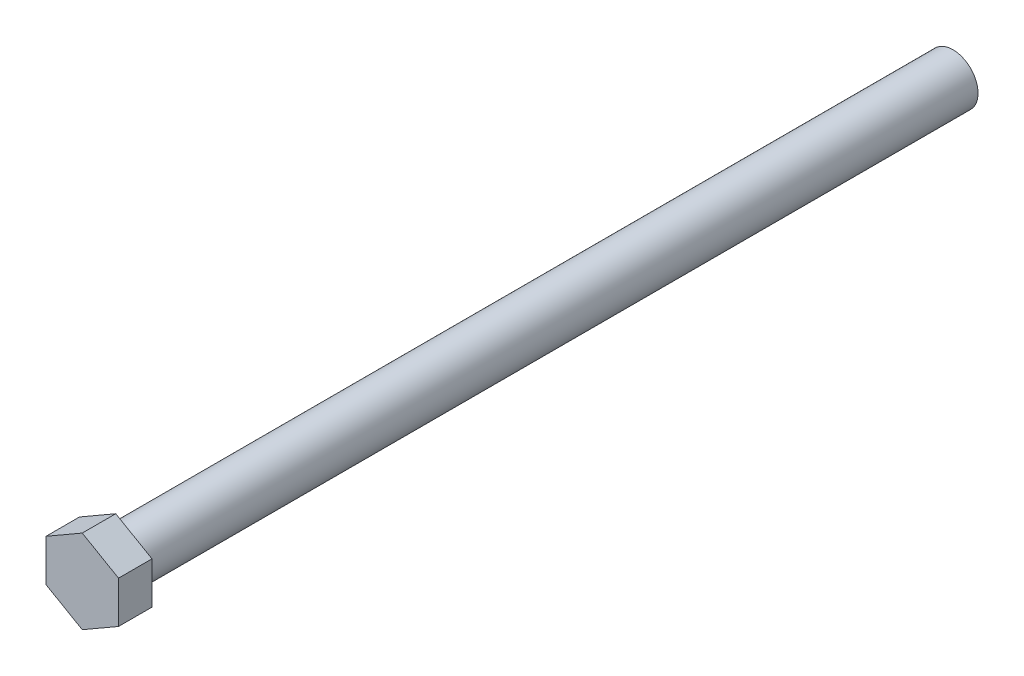
from build123d import *

# Parameters (mm, degrees)
BOSS_EXTRUDE1_DEPTH = 4
SKETCH2_R           = 3
BOSS_EXTRUDE2_DEPTH = 100


with BuildPart() as part:
    # Sketch1 → Boss-Extrude1 (new body)
    with BuildSketch(Plane(origin=(0, 0, 0), x_dir=(0, 1, 0), z_dir=(0, 0, 1))):
        Polygon((2.5, 4.330127019), (-2.5, 4.330127019), (-5, 0), (-2.5, -4.330127019), (2.5, -4.330127019), (5, 0), align=None)
    extrude(amount=BOSS_EXTRUDE1_DEPTH)

    # Sketch2 → Boss-Extrude2 (add)
    with BuildSketch(Plane(origin=(0, 0, 0), x_dir=(1, 0, 0), z_dir=(0, 0, -1))):
        with Locations(Location((0, 0, 0), (0, 0, 180))):
            Circle(SKETCH2_R)
    extrude(amount=BOSS_EXTRUDE2_DEPTH)


solid = part.part
